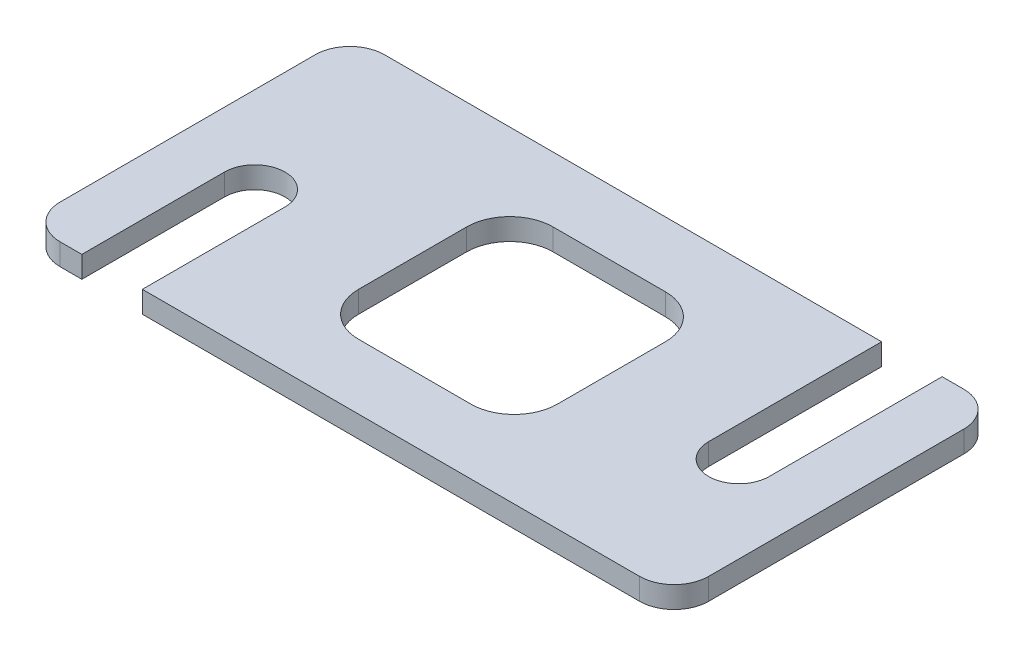
from build123d import *

# Parameters (mm, degrees)
SKETCH1_W           = 150
SKETCH1_H           = 75
BOSS_EXTRUDE1_DEPTH = 5
CUT_EXTRUDE1_DEPTH  = 168.779617356
CUT_EXTRUDE2_DEPTH  = 168.779617356
SKETCH4_W           = 46
SKETCH4_H           = 45
CUT_EXTRUDE3_DEPTH  = 168.779617356
FILLET1_R           = 10
FILLET2_R           = 8


with BuildPart() as part:
    # Sketch1 → Boss-Extrude1 (new body)
    with BuildSketch(Plane(origin=(0, 0, 0), x_dir=(1, 0, 0), z_dir=(0, 1, 0))):
        with Locations((75, 37.5)):
            Rectangle(SKETCH1_W, SKETCH1_H)
    extrude(amount=BOSS_EXTRUDE1_DEPTH)

    # Sketch2 → Cut-Extrude1 (cut, through all)
    with BuildSketch(Plane(origin=(0, 5, 0), x_dir=(1, 0, 0), z_dir=(0, 1, 0))):
        with BuildLine():
            Line((13, 0), (13, 33))
            ThreePointArc((13, 33), (20, 40), (27, 33))
            Line((27, 33), (27, 0))
            Line((27, 0), (13, 0))
        make_face()
    extrude(amount=-CUT_EXTRUDE1_DEPTH, mode=Mode.SUBTRACT)

    # Sketch3 → Cut-Extrude2 (cut, through all)
    with BuildSketch(Plane(origin=(0, 5, 0), x_dir=(1, 0, 0), z_dir=(0, 1, 0))):
        with BuildLine():
            Line((137, 75), (137, 35))
            ThreePointArc((137, 35), (130, 28), (123, 35))
            Line((123, 35), (123, 75))
            Line((123, 75), (137, 75))
        make_face()
    extrude(amount=-CUT_EXTRUDE2_DEPTH, mode=Mode.SUBTRACT)

    # Sketch4 → Cut-Extrude3 (cut, through all)
    with BuildSketch(Plane(origin=(0, 5, 0), x_dir=(1, 0, 0), z_dir=(0, 1, 0))):
        with Locations((75, 37.5)):
            Rectangle(SKETCH4_W, SKETCH4_H)
    extrude(amount=-CUT_EXTRUDE3_DEPTH, mode=Mode.SUBTRACT)

    # Fillet1
    fillet1_edges = [part.edges().sort_by_distance(p)[0] for p in [
        (52, 2.5, -15),
        (52, 2.5, -60),
        (98, 2.5, -60),
        (98, 2.5, -15),
    ]]
    fillet(fillet1_edges, radius=FILLET1_R)

    # Fillet2
    fillet2_edges = [part.edges().sort_by_distance(p)[0] for p in [
        (0, 2.5, -75),
        (150, 2.5, -75),
        (150, 2.5, 0),
        (0, 2.5, 0),
    ]]
    fillet(fillet2_edges, radius=FILLET2_R)


solid = part.part
